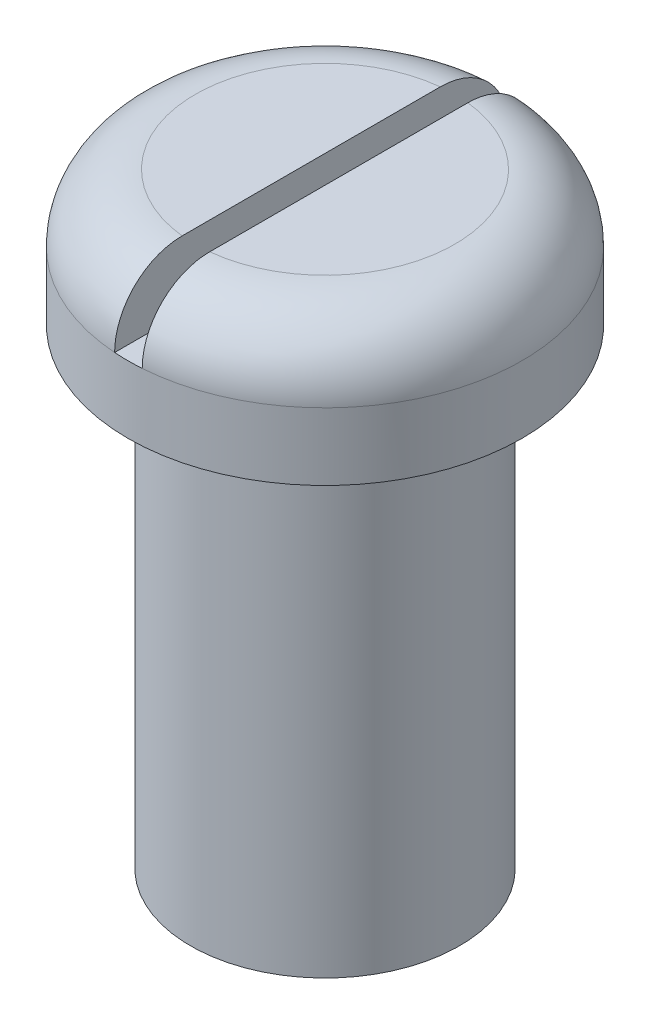
from build123d import *

# Parameters (mm, degrees)
CUT_EXTRUDE1_REACH             = 11.908
SKETCH2_W                      = 0.41
SKETCH2_H                      = 1
CUT_EXTRUDE1_DIRECTION_2_REACH = 11.908


with BuildPart() as part:
    # Sketch1 → Revolve1 (revolve)
    with BuildSketch(Plane.XY, mode=Mode.PRIVATE) as revolve1_sk:
        with BuildLine():
            Line((0, 9), (1.93, 9))
            ThreePointArc((1.93, 9), (2.637106781, 8.707106781), (2.93, 8))
            Line((2.93, 8), (2.93, 7))
            Line((2.93, 7), (2, 7))
            Line((2, 7), (2, 0))
            Line((2, 0), (0, 0))
            Line((0, 0), (0, 9))
        make_face()
    revolve(revolve1_sk.sketch.rotate(Axis((0, 0, 0), (0, 1, 0)), 90), axis=Axis((0, 0, 0), (0, 1, 0)))

    # Sketch2 → Cut-Extrude1 (cut, up to next)
    with BuildSketch(Plane.XY, mode=Mode.PRIVATE) as cut_extrude1_sk1:
        with Locations((0, 8.5)):
            Rectangle(SKETCH2_W, SKETCH2_H)
    cut_extrude1_tool1 = extrude(cut_extrude1_sk1.sketch, amount=-CUT_EXTRUDE1_REACH, mode=Mode.PRIVATE) & part.part
    add(cut_extrude1_tool1.solids().sort_by_distance((0, 8.5, 0))[0], mode=Mode.SUBTRACT)

    # Sketch2 → Cut-Extrude1 direction 2 (cut, up to next)
    with BuildSketch(Plane.XY, mode=Mode.PRIVATE) as cut_extrude1_direction_2_sk1:
        with Locations((0, 8.5)):
            Rectangle(SKETCH2_W, SKETCH2_H)
    cut_extrude1_direction_2_tool1 = extrude(cut_extrude1_direction_2_sk1.sketch, amount=CUT_EXTRUDE1_DIRECTION_2_REACH, mode=Mode.PRIVATE) & part.part
    add(cut_extrude1_direction_2_tool1.solids().sort_by_distance((0, 8.5, 0))[0], mode=Mode.SUBTRACT)


solid = part.part
